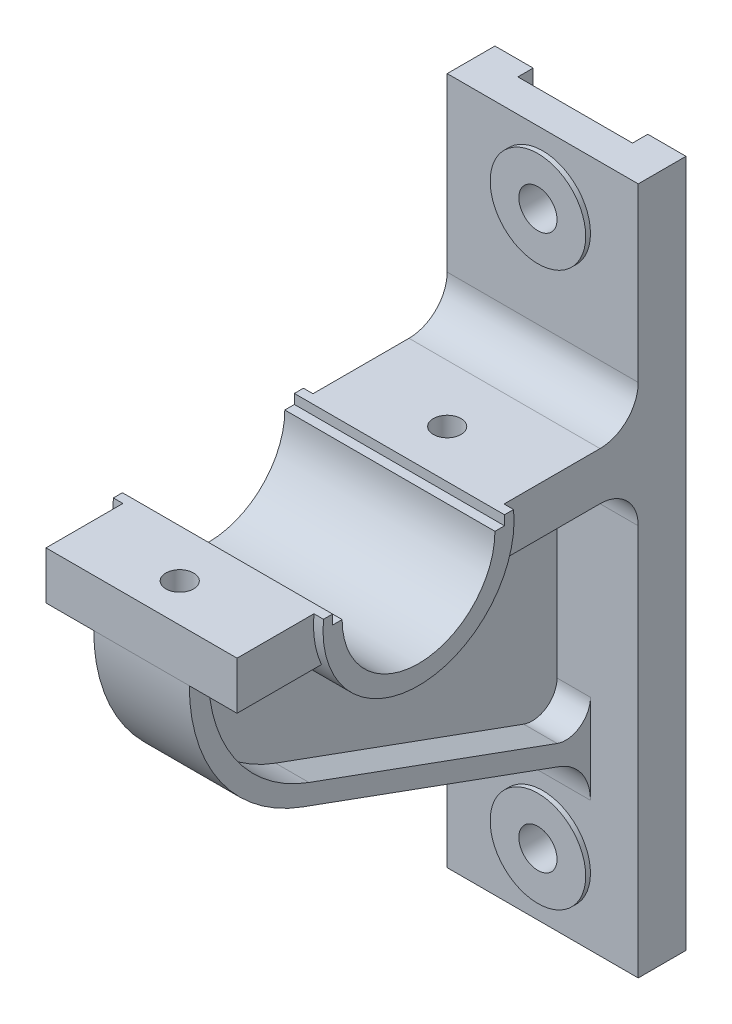
from build123d import *

# Parameters (mm, degrees)
BOSS_EXTRUDE1_DEPTH        = 50
BOSS_EXTRUDE1_2_DEPTH      = 50
BOSS_EXTRUDE3_DEPTH        = 55
BOSS_EXTRUDE4_DEPTH        = 25
BOSS_EXTRUDE5_DEPTH        = 7.5
M16X1_5_TAPPED_HOLE1_D     = 14.5
M16X1_5_TAPPED_HOLE1_DEPTH = 20.643760512
M16X1_5_TAPPED_HOLE1_TIP   = 4.356239488
SKETCH7_R                  = 25
SKETCH7_R_2                = 10
BOSS_EXTRUDE6_DEPTH        = 2.5
SKETCH7_2_R                = 10
CUT_EXTRUDE1_DEPTH         = 421.386726717
SKETCH8_W                  = 60
SKETCH8_H                  = 8
CUT_EXTRUDE2_DEPTH         = 434.416658655
FILLET1_R                  = 20
FILLET2_R                  = 10
FILLET3_R                  = 10
FILLET4_R                  = 13
FILLET5_R                  = 25


with BuildPart() as part:
    # Sketch2 → Boss-Extrude1 (new, symmetric)
    with BuildSketch(Plane(origin=(0, 0, 0), x_dir=(0, 0, -1), z_dir=(1, 0, 0))):
        with BuildLine():
            ThreePointArc((-190.82575695, 225), (-194.395357186, 237.247665611), (-194.749371855, 250))
            Line((-194.749371855, 250), (-235, 250))
            Line((-235, 250), (-235, 225))
            Line((-235, 225), (-190.82575695, 225))
        make_face()
    extrude(amount=BOSS_EXTRUDE1_DEPTH, both=True)



with BuildPart() as body_2:
    # Sketch2 → Boss-Extrude1 2 (new, symmetric)
    with BuildSketch(Plane(origin=(0, 0, 0), x_dir=(0, 0, -1), z_dir=(1, 0, 0))):
        with BuildLine():
            Line((-99.17424305, 225), (-25, 225))
            Line((-25, 225), (-25, 0))
            Line((-25, 0), (0, 0))
            Line((0, 0), (0, 360))
            Line((0, 360), (-25, 360))
            Line((-25, 360), (-25, 250))
            Line((-25, 250), (-95.250628145, 250))
            ThreePointArc((-95.250628145, 250), (-95.604642814, 237.247665611), (-99.17424305, 225))
        make_face()
    extrude(amount=BOSS_EXTRUDE1_2_DEPTH, both=True)


with BuildPart() as part_1:
    add(part.part)

    add(body_2.part)  # Boss-Extrude3 merges body 2
    # Sketch2<3> → Boss-Extrude3 (add, symmetric)
    with BuildSketch(Plane(origin=(0, 0, 0), x_dir=(0, 0, -1), z_dir=(1, 0, 0))):
        with BuildLine():
            Line((-185, 245), (-190, 245))
            Line((-190, 245), (-190, 250))
            Line((-190, 250), (-194.749371855, 250))
            ThreePointArc((-194.749371855, 250), (-145, 195), (-95.250628145, 250))
            Line((-95.250628145, 250), (-100, 250))
            Line((-100, 250), (-100, 245))
            Line((-100, 245), (-105, 245))
            ThreePointArc((-105, 245), (-145, 205), (-185, 245))
        make_face()
    extrude(amount=BOSS_EXTRUDE3_DEPTH, both=True)

    # Sketch4 → Boss-Extrude4 (add, symmetric)
    with BuildSketch(Plane(origin=(0, 0, 0), x_dir=(0, 0, -1), z_dir=(1, 0, 0))):
        with BuildLine():
            Line((-175.781812899, 140.427664129), (-25, 85.547572365))
            Line((-25, 85.547572365), (-25, 96.18935009))
            Line((-25, 96.18935009), (-172.361611466, 149.824590337))
            ThreePointArc((-172.361611466, 149.824590337), (-210.532163543, 179.113885092), (-225, 225))
            Line((-225, 225), (-235, 225))
            ThreePointArc((-235, 225), (-218.723683986, 173.378120728), (-175.781812899, 140.427664129))
        make_face()
    extrude(amount=BOSS_EXTRUDE4_DEPTH, both=True)

    # Sketch4<3> → Boss-Extrude5 (add, symmetric)
    with BuildSketch(Plane(origin=(0, 0, 0), x_dir=(0, 0, -1), z_dir=(1, 0, 0))):
        with BuildLine():
            Line((-172.361611466, 149.824590337), (-25, 96.18935009))
            Line((-25, 96.18935009), (-25, 225))
            Line((-25, 225), (-99.17424305, 225))
            ThreePointArc((-99.17424305, 225), (-145, 195), (-190.82575695, 225))
            Line((-190.82575695, 225), (-225, 225))
            ThreePointArc((-225, 225), (-210.532163543, 179.113885092), (-172.361611466, 149.824590337))
        make_face()
    extrude(amount=BOSS_EXTRUDE5_DEPTH, both=True)

    # M16x1.5 Tapped Hole1
    with Locations(Plane(origin=(0, 250, 0), x_dir=(1, 0, 0), z_dir=(0, 1, 0))):
        with Locations((0, -215), (0, -75)):
            Hole(M16X1_5_TAPPED_HOLE1_D / 2, depth=M16X1_5_TAPPED_HOLE1_DEPTH)
            with Locations((0, 0, -(M16X1_5_TAPPED_HOLE1_DEPTH + M16X1_5_TAPPED_HOLE1_TIP / 2))):  # 118° drill point
                Cone(0, M16X1_5_TAPPED_HOLE1_D / 2, M16X1_5_TAPPED_HOLE1_TIP, mode=Mode.SUBTRACT)

    # Sketch7 → Boss-Extrude6 (add, symmetric)
    # profile 1 of 2: a face of its own
    with BuildSketch(Plane.XY.offset(25)):
        with Locations((0, 325)):
            Circle(SKETCH7_R)
        with Locations((0, 325)):
            Circle(SKETCH7_R_2, mode=Mode.SUBTRACT)
    # profile 2 of 2: a face of its own
    with BuildSketch(Plane.XY.offset(25)):
        with Locations((0, 35)):
            Circle(SKETCH7_R)
        with Locations((0, 35)):
            Circle(SKETCH7_R_2, mode=Mode.SUBTRACT)
    extrude(amount=BOSS_EXTRUDE6_DEPTH, both=True)

    # Sketch7<2> → Cut-Extrude1 (cut, through all)
    with BuildSketch(Plane.XY.offset(25)):
        with Locations((0, 325)):
            Circle(SKETCH7_2_R)
        with Locations((0, 35)):
            Circle(SKETCH7_2_R)
    extrude(amount=-CUT_EXTRUDE1_DEPTH, mode=Mode.SUBTRACT)

    # Sketch8 → Cut-Extrude2 (cut, through all)
    with BuildSketch(Plane.XZ):
        with Locations((0, 4)):
            Rectangle(SKETCH8_W, SKETCH8_H)
    extrude(amount=-CUT_EXTRUDE2_DEPTH, mode=Mode.SUBTRACT)

    # Fillet1
    fillet1_edges = [part_1.edges().sort_by_distance(p)[0] for p in [
        (-28.75, 225, 25),
        (28.75, 225, 25),
        (0, 250, 25),
    ]]
    fillet(fillet1_edges, radius=FILLET1_R)

    # Fillet2
    fillet2_edges = [part_1.edges().sort_by_distance(p)[0] for p in [
        (16.25, 225, 225),
    ]]
    fillet(fillet2_edges, radius=FILLET2_R)

    # Fillet3
    fillet3_edges = [part_1.edges().sort_by_distance(p)[0] for p in [
        (-16.25, 225, 225),
    ]]
    fillet(fillet3_edges, radius=FILLET3_R)

    # Fillet4
    fillet4_edges = [part_1.edges().sort_by_distance(p)[0] for p in [
        (16.25, 96.18935009, 25),
        (-16.25, 96.18935009, 25),
    ]]
    fillet(fillet4_edges, radius=FILLET4_R)

    # Fillet5
    fillet5_edges = [part_1.edges().sort_by_distance(p)[0] for p in [
        (0, 85.547572365, 25),
    ]]
    fillet(fillet5_edges, radius=FILLET5_R)


solid = part_1.part
